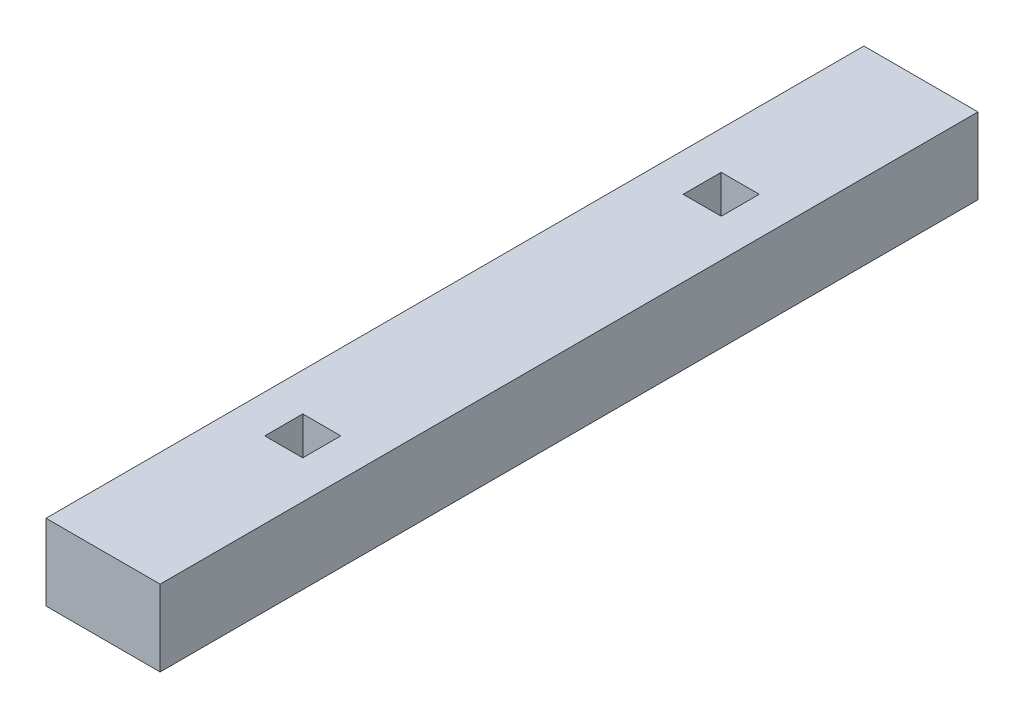
from build123d import *

# Parameters (mm, degrees)
SKETCH1_W           = 30
SKETCH1_H           = 215
SKETCH1_W_2         = 10
SKETCH1_H_2         = 10
BOSS_EXTRUDE1_DEPTH = 20


with BuildPart() as part:
    # Sketch1 → Boss-Extrude1 (new body)
    with BuildSketch(Plane(origin=(0, 0, 0), x_dir=(1, 0, 0), z_dir=(0, 1, 0))):
        with Locations((0, -5)):
            Rectangle(SKETCH1_W, SKETCH1_H)
        with Locations((0, 50)):
            Rectangle(SKETCH1_W_2, SKETCH1_H_2, mode=Mode.SUBTRACT)
        with Locations((0, -60)):
            Rectangle(SKETCH1_W_2, SKETCH1_H_2, mode=Mode.SUBTRACT)
    extrude(amount=BOSS_EXTRUDE1_DEPTH)


solid = part.part
